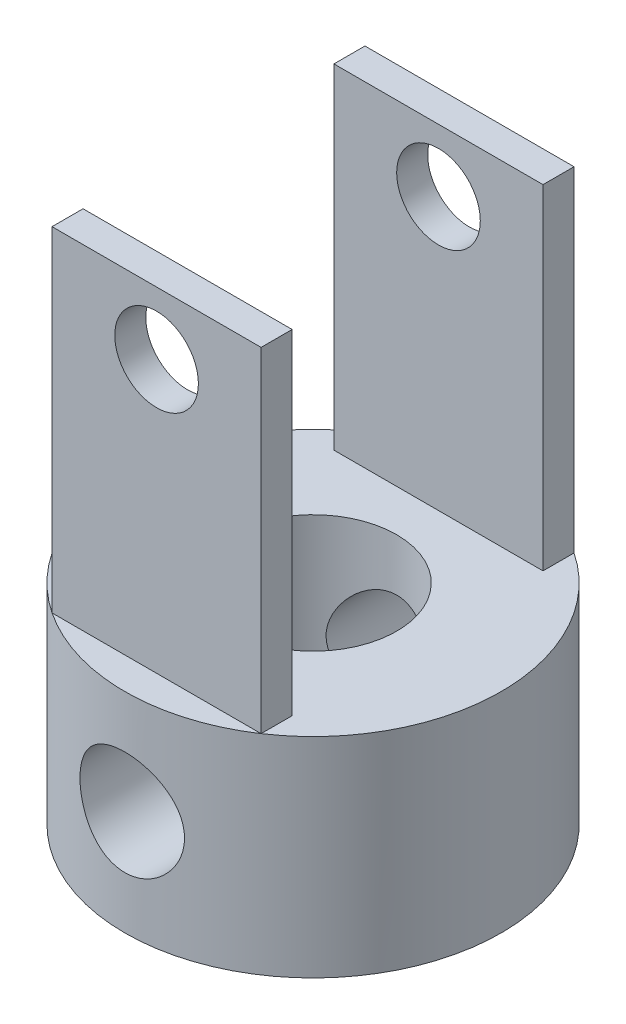
from build123d import *

# Parameters (mm, degrees)
SKETCH2_R           = 4.5
BOSS_EXTRUDE1_DEPTH = 5
SKETCH3_W           = 5
SKETCH3_H           = 0.741657387
BOSS_EXTRUDE2_DEPTH = 8
CUT_EXTRUDE1_REACH  = 18.037
SKETCH4_R           = 1
SKETCH6_R           = 2
CUT_EXTRUDE2_DEPTH  = 5


with BuildPart() as part:
    # Sketch2 → Boss-Extrude1 (new body)
    with BuildSketch(Plane(origin=(0, 0, 0), x_dir=(1, 0, 0), z_dir=(0, 1, 0))):
        with Locations(Location((0, 0, 0), (0, 0, 270))):
            Circle(SKETCH2_R)
    extrude(amount=BOSS_EXTRUDE1_DEPTH)

    # Sketch3 → Boss-Extrude2 (add)
    with BuildSketch(Plane(origin=(0, 5, 0), x_dir=(1, 0, 0), z_dir=(0, 1, 0))):
        with Locations((0, -3.370828694)):
            Rectangle(SKETCH3_W, SKETCH3_H)
        with Locations((0, 3.370828694)):
            Rectangle(SKETCH3_W, SKETCH3_H)
    extrude(amount=BOSS_EXTRUDE2_DEPTH)

    # Cut-Extrude1: up to this face of the body (flat: up to its plane)
    cut_extrude1_end = Plane(part.part.faces().sort_by_distance((0, 9, -3.741657387))[0])
    # Sketch4 → Cut-Extrude1 (cut, up to the picked face)
    with BuildSketch(Plane.XY.offset(3.741657387), mode=Mode.PRIVATE) as cut_extrude1_sk1:
        with Locations((0, 11.5)):
            Circle(SKETCH4_R)
    cut_extrude1_tool1 = split(extrude(cut_extrude1_sk1.sketch, amount=-CUT_EXTRUDE1_REACH, mode=Mode.PRIVATE), bisect_by=cut_extrude1_end, keep=Keep.BOTH, mode=Mode.PRIVATE)
    add(cut_extrude1_tool1.solids().sort_by(Axis((0, 11.5, 3.741657), (0, 0, -1)))[0], mode=Mode.SUBTRACT)

    # Sketch6 → Cut-Extrude2 (cut)
    with BuildSketch(Plane.XZ):
        with Locations(Location((0, 0, 0), (0, 0, 270))):
            Circle(SKETCH6_R)
    extrude(amount=-CUT_EXTRUDE2_DEPTH, mode=Mode.SUBTRACT)

    # Sketch9 → M3x0.5 Tapped Hole2 (revolve, cut)
    with BuildSketch(Plane(origin=(0, 2.5, 4.5), x_dir=(0, -1, 0), z_dir=(1, 0, 0))):
        Polygon((0, 0), (0, 4.499), (1.25, 3.747924226), (1.25, 0), align=None)
    m3x0_5_tapped_hole2 = revolve(axis=Axis((0, 2.5, 10.85), (0, 0, -1)), mode=Mode.SUBTRACT)

    # Mirror1: M3x0.5 Tapped Hole2 across plane
    add(m3x0_5_tapped_hole2.mirror(Plane.XY), mode=Mode.SUBTRACT)


solid = part.part
